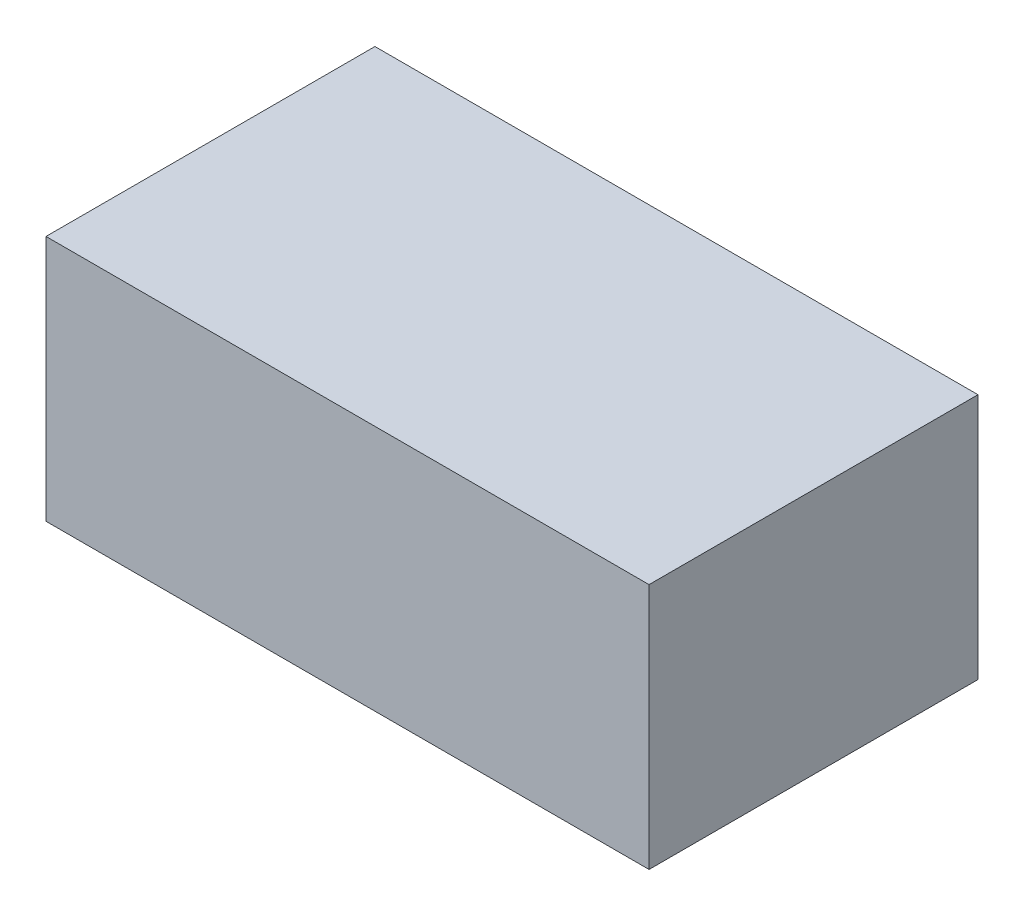
from build123d import *

# Parameters (mm, degrees)
SKETCH1_W           = 110
SKETCH1_H           = 60
BOSS_EXTRUDE1_DEPTH = 45


with BuildPart() as part:
    # Sketch1 → Boss-Extrude1 (new body)
    with BuildSketch(Plane(origin=(0, 0, 0), x_dir=(1, 0, 0), z_dir=(0, 1, 0))):
        Rectangle(SKETCH1_W, SKETCH1_H)
    extrude(amount=BOSS_EXTRUDE1_DEPTH)


solid = part.part
